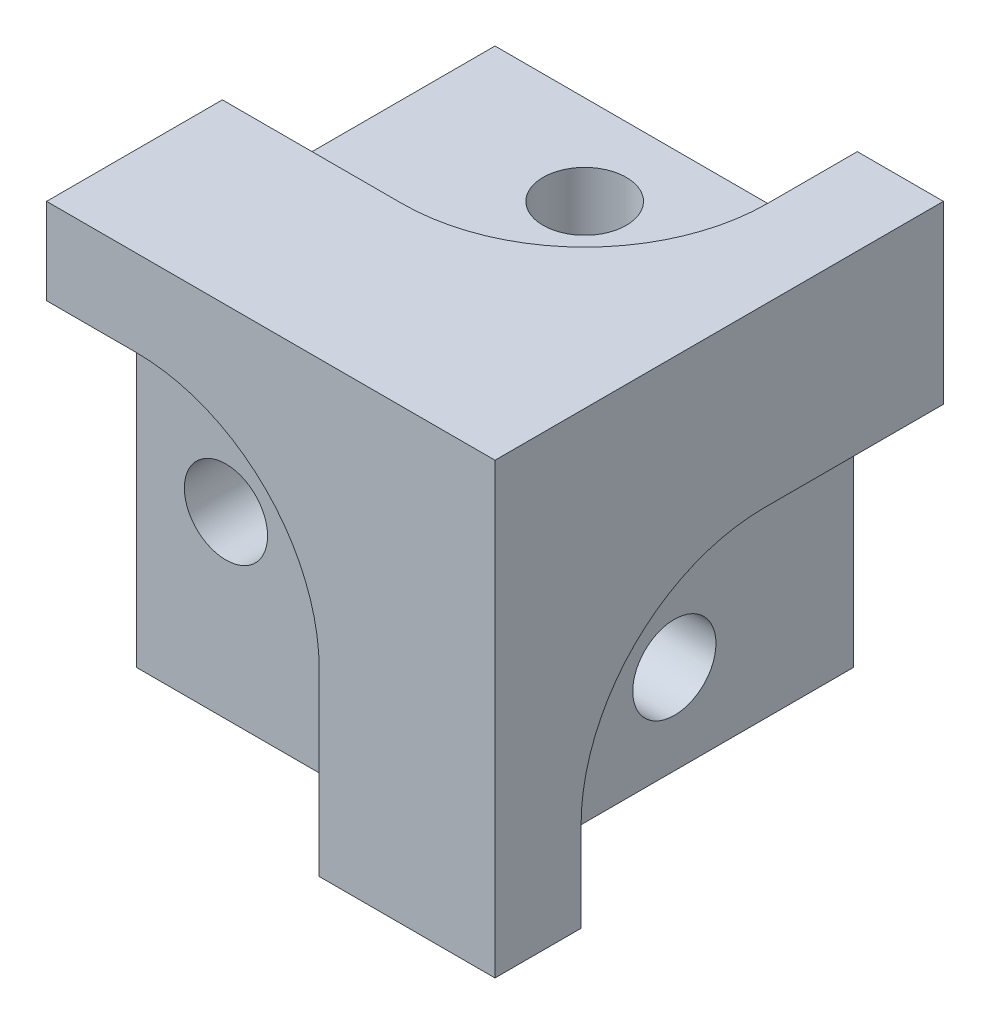
from build123d import *

# Parameters (mm, degrees)
CUBE_BASE_DEPTH       = 7.9375
CUBE_BASE_DEPTH_BACK  = 7.9375
SKETCH2_W             = 15.875
SKETCH2_H             = 15.875
F_4_CLEARANCE_HOLE1_D = 2.9464
FRAME_RELIEF_DEPTH    = 3.175
CIRPATTERN1_COUNT     = 3


with BuildPart() as part:
    # Sketch2 → CUBE-BASE (new, two sides: drawn at the far end of the back side and taken through both)
    with BuildSketch(Plane.XY.offset(-CUBE_BASE_DEPTH_BACK)):
        Rectangle(SKETCH2_W, SKETCH2_H)
    extrude(amount=CUBE_BASE_DEPTH + CUBE_BASE_DEPTH_BACK)

    # #4 Clearance Hole1 (through all)
    with Locations(Plane.XY.offset(7.9375)):
        with Locations((-4.7625, -1.5875)):
            f_4_clearance_hole1 = Hole(F_4_CLEARANCE_HOLE1_D / 2)

    # Sketch5 → FRAME-RELIEF (cut)
    with BuildSketch(Plane.XY.offset(7.9375)):
        with BuildLine():
            Line((-4.7625, 4.8895), (-7.9375, 4.8895))
            Line((-7.9375, 4.8895), (-7.9375, -7.9375))
            Line((-7.9375, -7.9375), (1.7145, -7.9375))
            Line((1.7145, -7.9375), (1.7145, -1.5875))
            ThreePointArc((1.7145, -1.5875), (-0.182569378, 2.992430622), (-4.7625, 4.8895))
        make_face()
    frame_relief = extrude(amount=-FRAME_RELIEF_DEPTH, mode=Mode.SUBTRACT)

    # CirPattern1: #4 Clearance Hole1, FRAME-RELIEF ×3 about axis
    cirpattern1_axis = Axis((7.9375, 7.9375, 7.9375), (-0.5773502691896257, -0.5773502691896257, -0.5773502691896257))
    add([f_4_clearance_hole1.rotate(cirpattern1_axis, i * 360 / CIRPATTERN1_COUNT) for i in range(1, CIRPATTERN1_COUNT)], mode=Mode.SUBTRACT)
    add([frame_relief.rotate(cirpattern1_axis, i * 360 / CIRPATTERN1_COUNT) for i in range(1, CIRPATTERN1_COUNT)], mode=Mode.SUBTRACT)


solid = part.part
